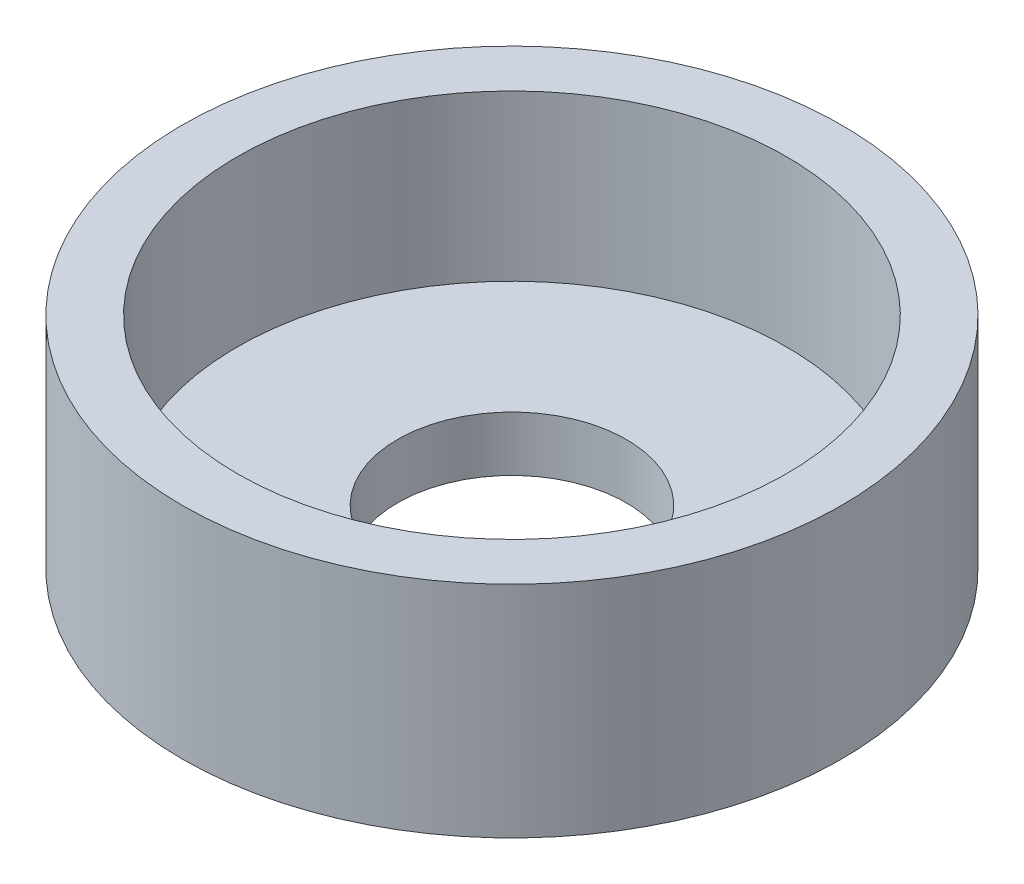
from build123d import *

# Parameters (mm, degrees)
SKETCH1_R           = 18
BOSS_EXTRUDE1_DEPTH = 12
SKETCH2_R           = 15
CUT_EXTRUDE1_DEPTH  = 9
SKETCH3_R           = 6.25
CUT_EXTRUDE2_DEPTH  = 9


with BuildPart() as part:
    # Sketch1 → Boss-Extrude1 (new body)
    with BuildSketch(Plane(origin=(0, 0, 0), x_dir=(1, 0, 0), z_dir=(0, 1, 0))):
        with Locations(Location((0, 0, 0), (0, 0, 270))):
            Circle(SKETCH1_R)
    extrude(amount=BOSS_EXTRUDE1_DEPTH)

    # Sketch2 → Cut-Extrude1 (cut)
    with BuildSketch(Plane(origin=(0, 12, 0), x_dir=(1, 0, 0), z_dir=(0, 1, 0))):
        with Locations(Location((0, 0, 0), (0, 0, 270))):
            Circle(SKETCH2_R)
    extrude(amount=-CUT_EXTRUDE1_DEPTH, mode=Mode.SUBTRACT)

    # Sketch3 → Cut-Extrude2 (cut)
    with BuildSketch(Plane(origin=(0, 3, 0), x_dir=(1, 0, 0), z_dir=(0, 1, 0))):
        with Locations(Location((0, 0, 0), (0, 0, 270))):
            Circle(SKETCH3_R)
    extrude(amount=-CUT_EXTRUDE2_DEPTH, mode=Mode.SUBTRACT)


solid = part.part
